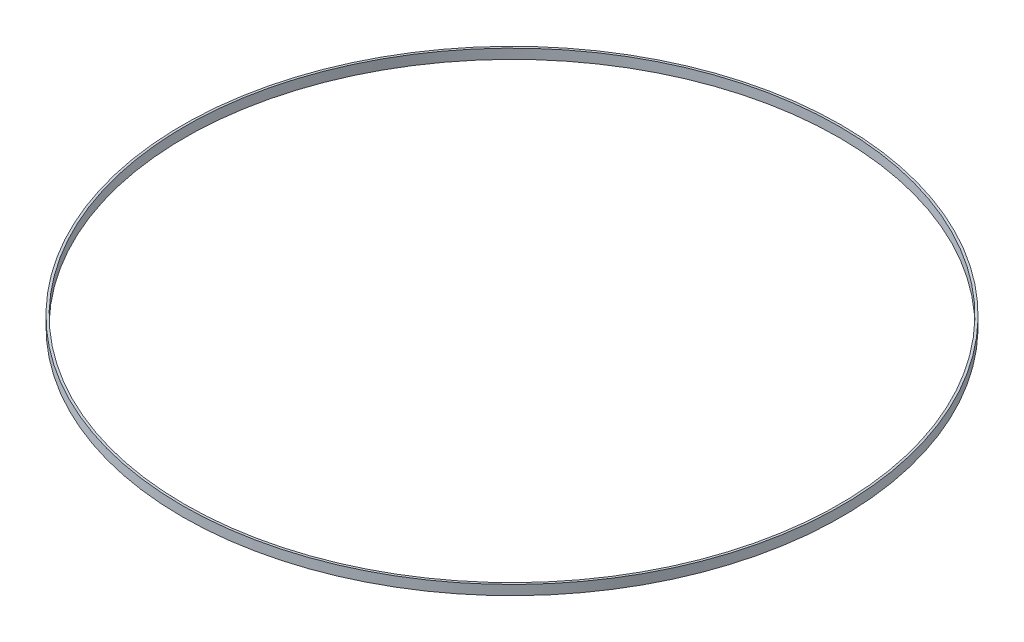
from build123d import *

# Parameters (mm, degrees)
SKETCH1_R           = 440
SKETCH1_R_2         = 437
BOSS_EXTRUDE1_DEPTH = 13


with BuildPart() as part:
    # Sketch1 → Boss-Extrude1 (new body)
    with BuildSketch(Plane(origin=(0, 0, 0), x_dir=(1, 0, 0), z_dir=(0, 1, 0))):
        Circle(SKETCH1_R)
        Circle(SKETCH1_R_2, mode=Mode.SUBTRACT)
    extrude(amount=BOSS_EXTRUDE1_DEPTH)


solid = part.part
